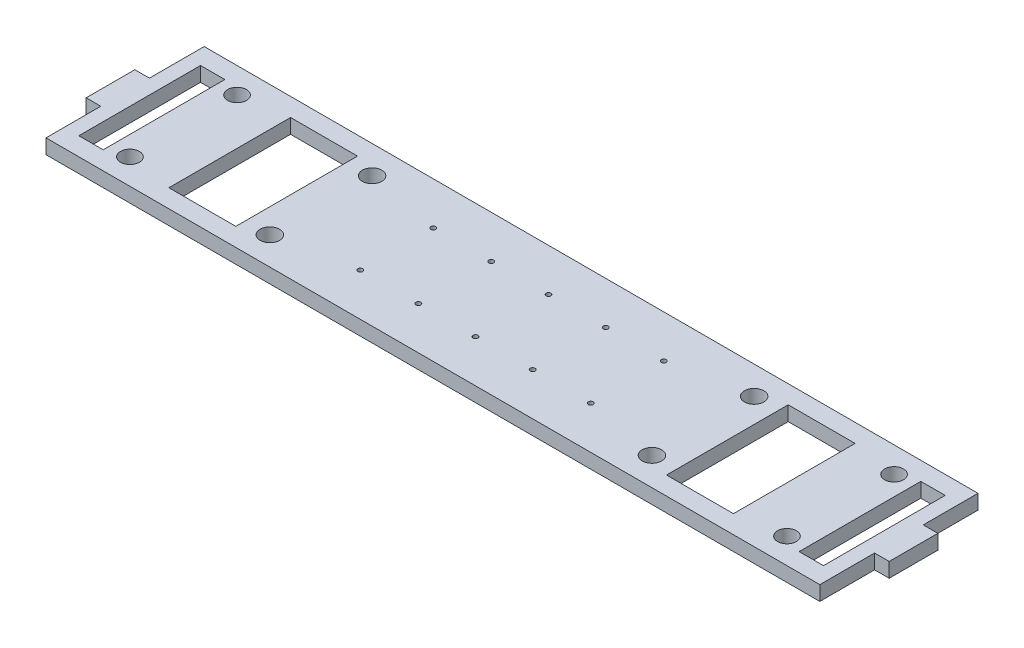
from build123d import *

# Parameters (mm, degrees)
BOSS_EXTRU_1_DEPTH      = 6
ESQUISSE2_R             = 1.005
ENL_V_MAT_EXTRU_1_DEPTH = 169.277300905
ESQUISSE3_R             = 3
ENL_V_MAT_EXTRU_2_DEPTH = 3
ESQUISSE4_R             = 4
ENL_V_MAT_EXTRU_3_DEPTH = 169.277300905
ESQUISSE5_W             = 27.5
ESQUISSE5_H             = 50
ENL_V_MAT_EXTRU_4_DEPTH = 169.277300905
ESQUISSE6_R             = 3.875
ENL_V_MAT_EXTRU_5_DEPTH = 169.277300905
ESQUISSE7_W             = 10
ESQUISSE7_H             = 50
ENL_V_MAT_EXTRU_6_DEPTH = 169.277300905


with BuildPart() as part:
    # Esquisse1 → Boss.-Extru.1 (new body)
    with BuildSketch(Plane(origin=(0, 0, 0), x_dir=(1, 0, 0), z_dir=(0, 1, 0))):
        Polygon((-159, -32.5), (-159, -10), (-165, -10), (-165, 10), (-159, 10), (-159, 32.5), (159, 32.5), (159, 10), (165, 10), (165, -10), (159, -10), (159, -32.5), align=None)
    extrude(amount=BOSS_EXTRU_1_DEPTH)

    # Esquisse2 → Enlèv. mat.-Extru.1 (cut, through all)
    with BuildSketch(Plane.XZ):
        with Locations(Location((-47.35, 15, 0), (0, 0, 270))):
            Circle(ESQUISSE2_R)
        with Locations(Location((-23.5, 15, 0), (0, 0, 270))):
            Circle(ESQUISSE2_R)
        with Locations(Location((23.5, 15, 0), (0, 0, 90))):
            Circle(ESQUISSE2_R)
        with Locations(Location((47.35, 15, 0), (0, 0, 90))):
            Circle(ESQUISSE2_R)
        with Locations(Location((47.35, -15, 0), (0, 0, 270))):
            Circle(ESQUISSE2_R)
        with Locations(Location((23.5, -15, 0), (0, 0, 270))):
            Circle(ESQUISSE2_R)
        with Locations(Location((-23.5, -15, 0), (0, 0, 90))):
            Circle(ESQUISSE2_R)
        with Locations(Location((-47.35, -15, 0), (0, 0, 90))):
            Circle(ESQUISSE2_R)
        with Locations(Location((0, 15, 0), (0, 0, 270))):
            Circle(ESQUISSE2_R)
        with Locations(Location((0, -15, 0), (0, 0, 90))):
            Circle(ESQUISSE2_R)
    extrude(amount=-ENL_V_MAT_EXTRU_1_DEPTH, mode=Mode.SUBTRACT)

    # Esquisse3 → Enlèv. mat.-Extru.2 (cut)
    with BuildSketch(Plane(origin=(0, 0, 0), x_dir=(-1, 0, 0), z_dir=(0, -1, 0))):
        with Locations(Location((47.35, -15, 0), (0, 0, 90))):
            Circle(ESQUISSE3_R)
        with Locations(Location((23.5, -15, 0), (0, 0, 90))):
            Circle(ESQUISSE3_R)
        with Locations(Location((0, -15, 0), (0, 0, 90))):
            Circle(ESQUISSE3_R)
        with Locations(Location((0, 15, 0), (0, 0, 270))):
            Circle(ESQUISSE3_R)
        with Locations(Location((23.5, 15, 0), (0, 0, 270))):
            Circle(ESQUISSE3_R)
        with Locations(Location((47.35, 15, 0), (0, 0, 270))):
            Circle(ESQUISSE3_R)
        with Locations(Location((-47.35, 15, 0), (0, 0, 90))):
            Circle(ESQUISSE3_R)
        with Locations(Location((-23.5, 15, 0), (0, 0, 90))):
            Circle(ESQUISSE3_R)
        with Locations(Location((-23.5, -15, 0), (0, 0, 270))):
            Circle(ESQUISSE3_R)
        with Locations(Location((-47.35, -15, 0), (0, 0, 270))):
            Circle(ESQUISSE3_R)
    extrude(amount=-ENL_V_MAT_EXTRU_2_DEPTH, mode=Mode.SUBTRACT)

    # Esquisse4 → Enlèv. mat.-Extru.3 (cut, through all)
    with BuildSketch(Plane(origin=(0, 0, 0), x_dir=(-1, 0, 0), z_dir=(0, -1, 0))):
        with Locations(Location((78.5, -21, 0), (0, 0, 90))):
            Circle(ESQUISSE4_R)
        with Locations(Location((-78.5, -21, 0), (0, 0, 270))):
            Circle(ESQUISSE4_R)
        with Locations(Location((78.5, 21, 0), (0, 0, 270))):
            Circle(ESQUISSE4_R)
        with Locations(Location((-78.5, 21, 0), (0, 0, 90))):
            Circle(ESQUISSE4_R)
    extrude(amount=-ENL_V_MAT_EXTRU_3_DEPTH, mode=Mode.SUBTRACT)

    # Esquisse5 → Enlèv. mat.-Extru.4 (cut, through all)
    with BuildSketch(Plane(origin=(0, 0, 0), x_dir=(-1, 0, 0), z_dir=(0, -1, 0))):
        with Locations((102.25, 0)):
            Rectangle(ESQUISSE5_W, ESQUISSE5_H)
        with Locations((-102.25, 0)):
            Rectangle(ESQUISSE5_W, ESQUISSE5_H)
    extrude(amount=-ENL_V_MAT_EXTRU_4_DEPTH, mode=Mode.SUBTRACT)

    # Esquisse6 → Enlèv. mat.-Extru.5 (cut, through all)
    with BuildSketch(Plane(origin=(0, 0, 0), x_dir=(-1, 0, 0), z_dir=(0, -1, 0))):
        with Locations(Location((135, -22, 0), (0, 0, 90))):
            Circle(ESQUISSE6_R)
        with Locations(Location((-135, -22, 0), (0, 0, 270))):
            Circle(ESQUISSE6_R)
        with Locations(Location((-135, 22, 0), (0, 0, 90))):
            Circle(ESQUISSE6_R)
        with Locations(Location((135, 22, 0), (0, 0, 270))):
            Circle(ESQUISSE6_R)
    extrude(amount=-ENL_V_MAT_EXTRU_5_DEPTH, mode=Mode.SUBTRACT)

    # Esquisse7 → Enlèv. mat.-Extru.6 (cut, through all)
    with BuildSketch(Plane(origin=(0, 0, 0), x_dir=(-1, 0, 0), z_dir=(0, -1, 0))):
        with Locations((148, 0)):
            Rectangle(ESQUISSE7_W, ESQUISSE7_H)
        with Locations((-148, 0)):
            Rectangle(ESQUISSE7_W, ESQUISSE7_H)
    extrude(amount=-ENL_V_MAT_EXTRU_6_DEPTH, mode=Mode.SUBTRACT)


solid = part.part
